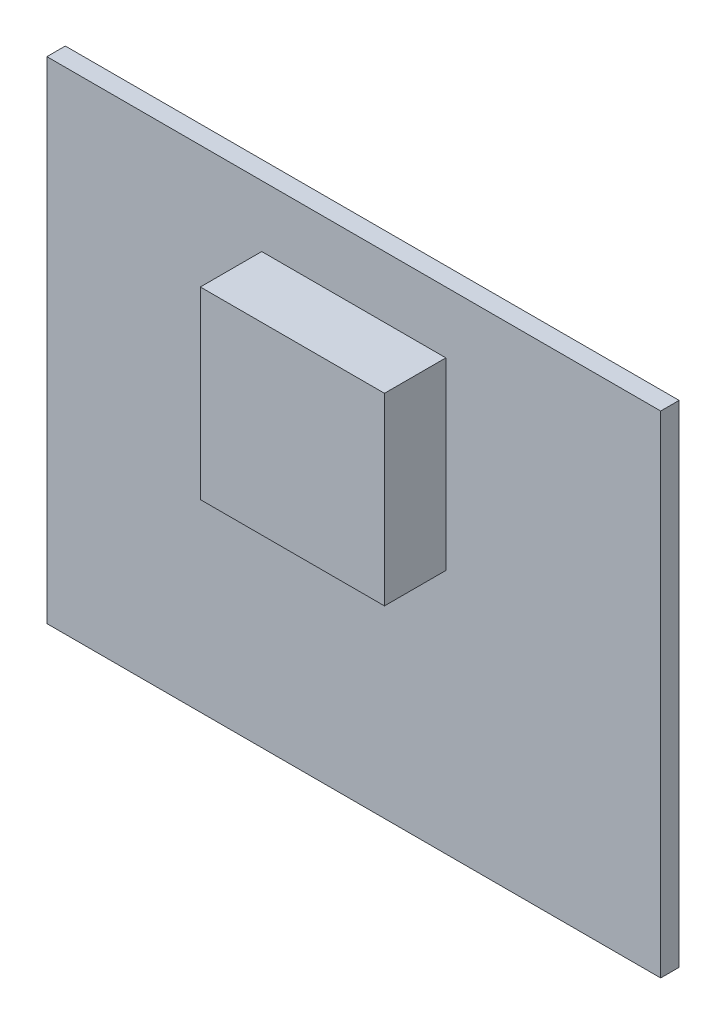
from build123d import *

# Parameters (mm, degrees)
SKETCH1_W           = 100
SKETCH1_H           = 80
BOSS_EXTRUDE1_DEPTH = 3
SKETCH2_W           = 30
SKETCH2_H           = 30
BOSS_EXTRUDE2_DEPTH = 10


with BuildPart() as part:
    # Sketch1 → Boss-Extrude1 (new body)
    with BuildSketch(Plane.XY):
        Rectangle(SKETCH1_W, SKETCH1_H)
    extrude(amount=BOSS_EXTRUDE1_DEPTH)

    # Sketch2 → Boss-Extrude2 (add)
    with BuildSketch(Plane.XY.offset(3)):
        with Locations((0, 15)):
            Rectangle(SKETCH2_W, SKETCH2_H)
    extrude(amount=BOSS_EXTRUDE2_DEPTH)


solid = part.part
